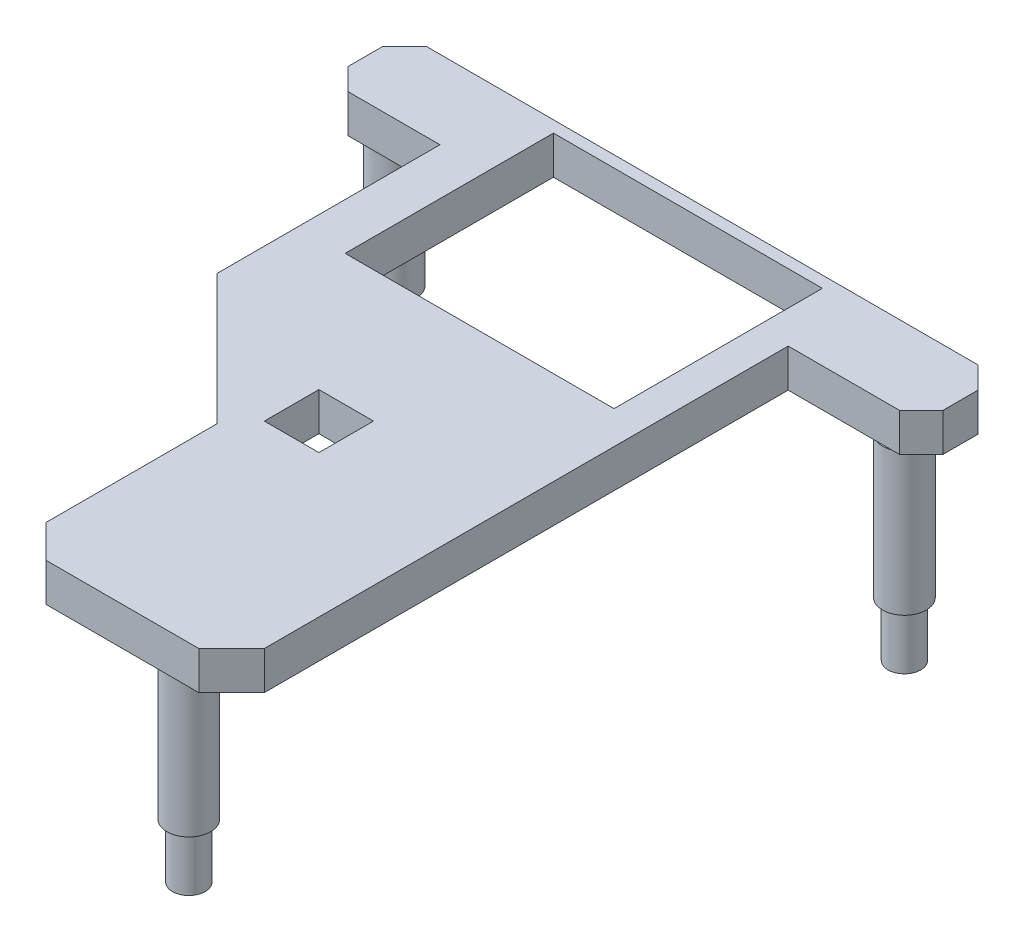
from build123d import *

# Parameters (mm, degrees)
SKETCH4_W           = 24.633837396
SKETCH4_H           = 19.082768461
SKETCH4_W_2         = 5
SKETCH4_H_2         = 5
MAINBRACKET_DEPTH   = 3.5
SKETCH3_R           = 2
BOSS_EXTRUDE2_DEPTH = 13
SKETCH6_R           = 1.5
BOSS_EXTRUDE3_DEPTH = 5


with BuildPart() as part:
    # Sketch4 → MainBracket (new body)
    with BuildSketch(Plane(origin=(0, 0, 0), x_dir=(1, 0, 0), z_dir=(0, 1, 0))):
        Polygon((-25.001052975, 23.597895529), (25.52718448, 23.597895529), (27.52718448, 21.597895529), (27.52718448, 18.397895529), (25.52718448, 16.397895529), (15.338231538, 16.397895529), (15.338231538, -31.590979949), (12.338231538, -34.590979949), (-1.661768462, -34.590979949), (-4.661768462, -31.590979949), (-4.661768462, -15.921260677), (-16.583029139, -4), (-16.583029139, 16.421906692), (-25.001052975, 16.421906692), (-27.001052975, 18.421906692), (-27.001052975, 21.597895529), align=None)
        with Locations((0.008956485, 13.000441896)):
            Rectangle(SKETCH4_W, SKETCH4_H, mode=Mode.SUBTRACT)
        with Locations((-0.204070078, -11.047717724)):
            Rectangle(SKETCH4_W_2, SKETCH4_H_2, mode=Mode.SUBTRACT)
    extrude(amount=MAINBRACKET_DEPTH)

    # Sketch3 → Boss-Extrude2 (add)
    with BuildSketch(Plane(origin=(0, 0, 0), x_dir=(1, 0, 0), z_dir=(0, 1, 0))):
        with Locations((-24.011269627, 19.663273311)):
            Circle(SKETCH3_R)
        with Locations((24.107482847, 18.27469294)):
            Circle(SKETCH3_R)
        with Locations((8.917908931, -32.088026328)):
            Circle(SKETCH3_R)
    extrude(amount=-BOSS_EXTRUDE2_DEPTH)

    # Sketch6 → Boss-Extrude3 (add)
    with BuildSketch(Plane.XZ.offset(13)):
        with Locations((-24.011269627, -19.663273311)):
            Circle(SKETCH6_R)
        with Locations((8.917908931, 32.088026328)):
            Circle(SKETCH6_R)
        with Locations((24.107482847, -18.27469294)):
            Circle(SKETCH6_R)
    extrude(amount=BOSS_EXTRUDE3_DEPTH)


solid = part.part
